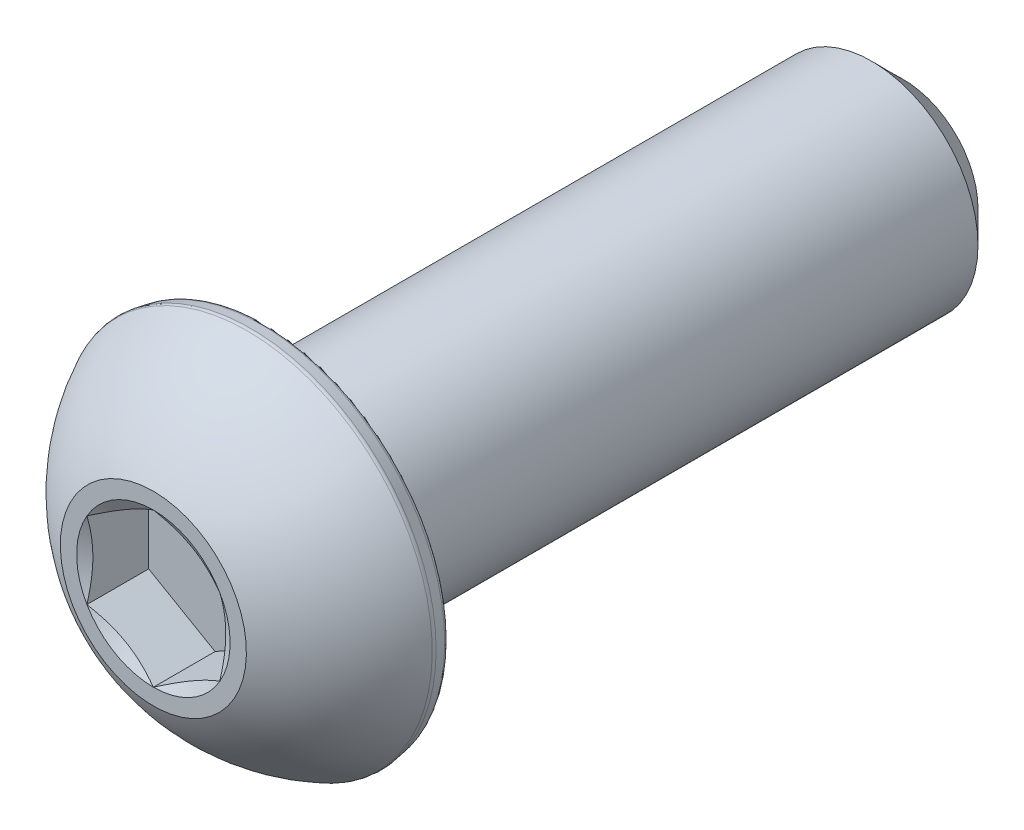
from build123d import *

# Parameters (mm, degrees)
CUT_EXTRUDE1_DEPTH = 1.84404
FILLET1_R          = 0.16764


with BuildPart() as part:
    # Sketch3 → Revolve1 (revolve)
    with BuildSketch(Plane(origin=(0, 0, 0), x_dir=(0, 0, -1), z_dir=(1, 0, 0)), mode=Mode.PRIVATE) as revolve1_sk:
        with BuildLine():
            Line((-11.2014, 0), (-11.2014, 2.778125))
            ThreePointArc((-11.2014, 2.778125), (-10.007024687, 4.401074199), (-8.35152, 5.5499))
            Line((-8.35152, 5.5499), (-7.8486, 5.461221635))
            Line((-7.8486, 5.461221635), (-7.8486, 3.175))
            Line((-7.8486, 3.175), (10.2489, 3.175))
            Line((10.2489, 3.175), (11.2014, 2.2225))
            Line((11.2014, 2.2225), (11.2014, 0))
            Line((11.2014, 0), (-11.2014, 0))
        make_face()
    revolve(revolve1_sk.sketch.rotate(Axis((0, 0, 11.2014), (0, 0, -1)), 90), axis=Axis((0, 0, 11.2014), (0, 0, -1)))

    # Sketch4 → Cut-Extrude1 (cut)
    with BuildSketch(Plane.XY.offset(11.2014)):
        Polygon((-1.984375, -1.14567944), (0, -2.291358881), (1.984375, -1.14567944), (1.984375, 1.14567944), (0, 2.291358881), (-1.984375, 1.14567944), align=None)
    extrude(amount=-CUT_EXTRUDE1_DEPTH, mode=Mode.SUBTRACT)

    # Cut-Extrude2 cone 1 section (through the dimple's axis) → Cut-Extrude2 (revolve, cut)
    with BuildSketch(Plane(origin=(0, 0, 11.2014), x_dir=(0, -1, 0), z_dir=(1, 0, 0))):
        Polygon((0, 0), (2.291358881, 0), (0, 1.322916667), align=None)
    revolve(axis=Axis((0, 0, 11.2014), (0, 0, -1)), mode=Mode.SUBTRACT)

    # Fillet1
    fillet1_edges = [part.edges().sort_by_distance(p)[0] for p in [
        (-5.461221635, 0, 7.8486),
        (-5.5499, 0, 8.35152),
    ]]
    fillet(fillet1_edges, radius=FILLET1_R)


solid = part.part
